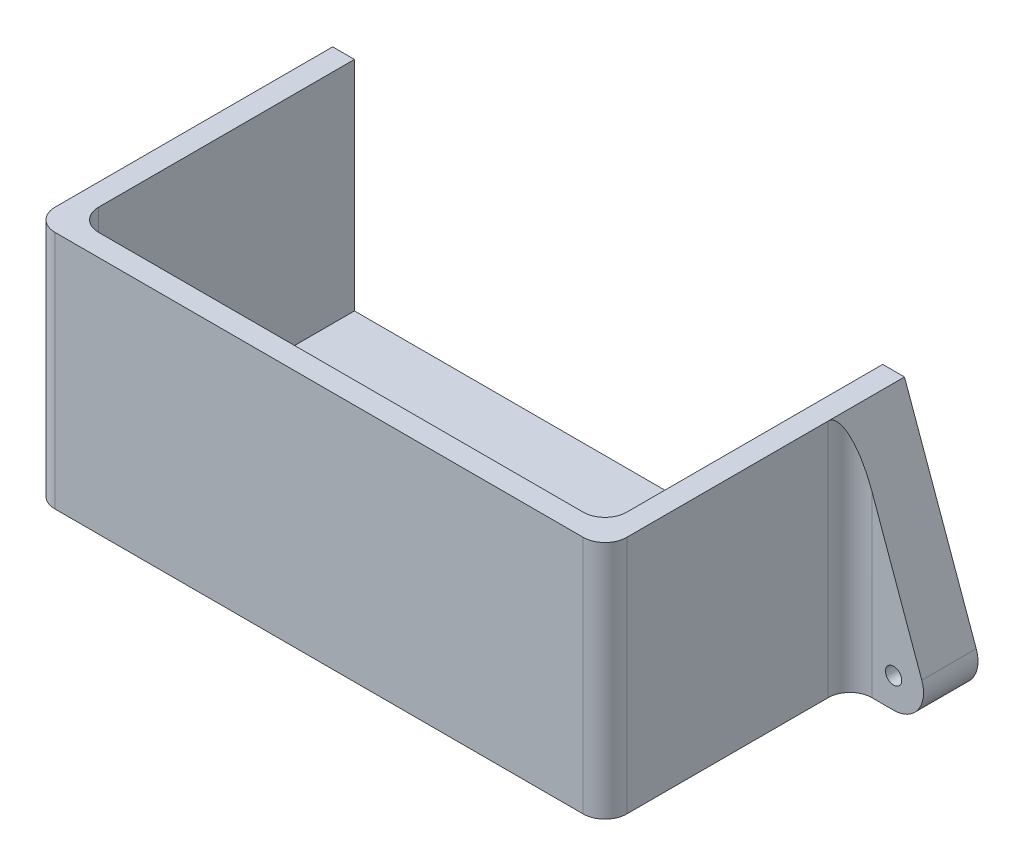
from build123d import *

# Parameters (mm, degrees)
SKETCH1_W           = 52.5
SKETCH1_H           = 27.5
BOSS_EXTRUDE1_DEPTH = 2
BOSS_EXTRUDE2_DEPTH = 20
FILLET1_R           = 2
SKETCH3_R           = 0.75
BOSS_EXTRUDE3_DEPTH = 5
FILLET3_R           = 2


with BuildPart() as part:
    # Sketch1 → Boss-Extrude1 (new body)
    with BuildSketch(Plane(origin=(0, 0, 0), x_dir=(1, 0, 0), z_dir=(0, 1, 0))):
        with Locations((0, -1)):
            Rectangle(SKETCH1_W, SKETCH1_H)
    extrude(amount=BOSS_EXTRUDE1_DEPTH)

    # Sketch2 → Boss-Extrude2 (add)
    with BuildSketch(Plane(origin=(0, 2, 0), x_dir=(1, 0, 0), z_dir=(0, 1, 0))):
        Polygon((26.25, -14.75), (26.25, 12.75), (24.25, 12.75), (24.25, -12.75), (-24.25, -12.75), (-24.25, 12.75), (-26.25, 12.75), (-26.25, -14.75), align=None)
    extrude(amount=BOSS_EXTRUDE2_DEPTH)

    # Fillet1
    fillet1_edges = [part.edges().sort_by_distance(p)[0] for p in [
        (24.25, 12, 12.75),
        (-24.25, 12, 12.75),
        (26.25, 11, 14.75),
        (-26.25, 11, 14.75),
    ]]
    fillet(fillet1_edges, radius=FILLET1_R)

    # Sketch3 → Boss-Extrude3 (add)
    with BuildSketch(Plane(origin=(0, 0, -12.75), x_dir=(-1, 0, 0), z_dir=(0, 0, -1))):
        with BuildLine():
            Line((-26.25, 22), (-32.837765597, 3.680574669))
            ThreePointArc((-32.837765597, 3.680574669), (-32.499620006, 1.168320567), (-30.25, 0))
            Line((-30.25, 0), (-26.25, 0))
            Line((-26.25, 0), (-26.25, 22))
        make_face()
        with Locations((-30.25, 2.75)):
            Circle(SKETCH3_R, mode=Mode.SUBTRACT)
    boss_extrude3 = extrude(amount=-BOSS_EXTRUDE3_DEPTH)

    # Mirror3: Boss-Extrude3 across plane
    add(boss_extrude3.mirror(Plane(origin=(0, 0, 0), x_dir=(0, 0, 1), z_dir=(1, 0, 0))))

    # Fillet3
    fillet3_edges = [part.edges().sort_by_distance(p)[0] for p in [
        (26.25, 11, -7.75),
        (-26.25, 11, -7.75),
    ]]
    fillet(fillet3_edges, radius=FILLET3_R)


solid = part.part
